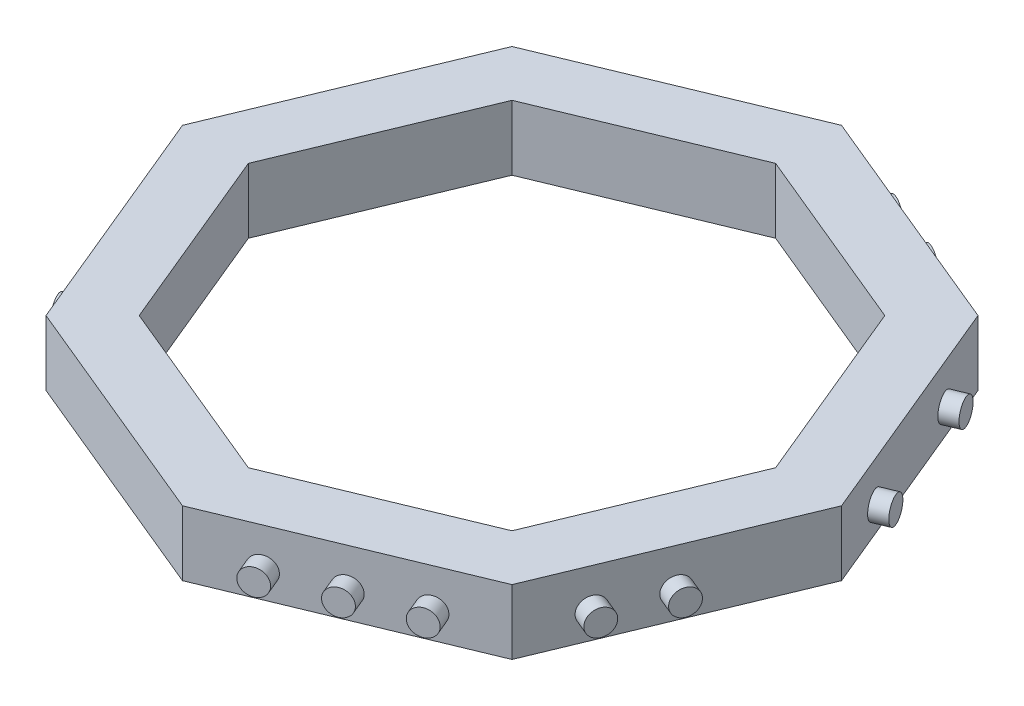
from build123d import *

# Parameters (mm, degrees)
BOSS_EXTRUDE1_DEPTH  = 5
CUT_EXTRUDE1_DEPTH   = 5
SKETCH6_R            = 1
BOSS_EXTRUDE5_DEPTH  = 1.25
SKETCH7_R            = 1
BOSS_EXTRUDE6_DEPTH  = 1.25
SKETCH8_R            = 1
BOSS_EXTRUDE7_DEPTH  = 1.25
BOSS_EXTRUDE8_START  = 1.25
SKETCH9_R            = 1
BOSS_EXTRUDE8_DEPTH  = 1.25
SKETCH10_R           = 1
BOSS_EXTRUDE9_DEPTH  = 1.25
BOSS_EXTRUDE10_START = 1.25
SKETCH11_R           = 1
BOSS_EXTRUDE10_DEPTH = 1.25
BOSS_EXTRUDE11_START = 1.25
SKETCH12_R           = 1
BOSS_EXTRUDE11_DEPTH = 1.25


with BuildPart() as part:
    # Sketch3 → Boss-Extrude1 (new body)
    with BuildSketch(Plane(origin=(0, 0, 0), x_dir=(1, 0, 0), z_dir=(0, 1, 0))):
        Polygon((25.4, 0), (17.960512242, 17.960512242), (0, 25.4), (-17.960512242, 17.960512242), (-25.4, 0), (-17.960512242, -17.960512242), (0, -25.4), (17.960512242, -17.960512242), align=None)
    extrude(amount=BOSS_EXTRUDE1_DEPTH)

    # Sketch5 → Cut-Extrude1 (cut)
    with BuildSketch(Plane(origin=(0, 5, 0), x_dir=(1, 0, 0), z_dir=(0, 1, 0))):
        Polygon((20.32, 0), (14.368409794, 14.368409794), (0, 20.32), (-14.368409794, 14.368409794), (-20.32, 0), (-14.368409794, -14.368409794), (0, -20.32), (14.368409794, -14.368409794), align=None)
    extrude(amount=-CUT_EXTRUDE1_DEPTH, mode=Mode.SUBTRACT)

    # Sketch6 → Boss-Extrude5 (add)
    with BuildSketch(Plane(origin=(8.980256121, 0, 21.680256121), x_dir=(0.9238795325112827, 0, -0.38268343236509966), z_dir=(0.38268343236509966, 0, 0.9238795325112827))):
        with Locations(Location((0, 2, 0), (0, 0, 180))):
            Circle(SKETCH6_R)
        with Locations(Location((-5, 2, 0), (0, 0, 180))):
            Circle(SKETCH6_R)
        with Locations(Location((5, 2, 0), (0, 0, 180))):
            Circle(SKETCH6_R)
    extrude(amount=BOSS_EXTRUDE5_DEPTH)

    # Sketch7 → Boss-Extrude6 (add)
    with BuildSketch(Plane(origin=(-21.680256121, 0, 8.980256121), x_dir=(0.3826834323650997, 0, 0.9238795325112827), z_dir=(-0.9238795325112827, 0, 0.3826834323650997))):
        with Locations(Location((5, 2, 0), (0, 0, 180))):
            Circle(SKETCH7_R)
    extrude(amount=BOSS_EXTRUDE6_DEPTH)

    # Sketch8 → Boss-Extrude7 (add)
    with BuildSketch(Plane(origin=(-21.680256121, 0, -8.980256121), x_dir=(-0.3826834323650795, 0, 0.9238795325112911), z_dir=(-0.9238795325112911, 0, -0.3826834323650795))):
        with Locations(Location((0, 2, 0), (0, 0, 180))):
            Circle(SKETCH8_R)
    extrude(amount=BOSS_EXTRUDE7_DEPTH)

    # Sketch9 → Boss-Extrude8 (add)
    with BuildSketch(Plane(origin=(-8.980256121, 0, -21.680256121), x_dir=(-0.9238795325112826, 0, 0.38268343236509983), z_dir=(-0.38268343236509983, 0, -0.9238795325112826)).offset(BOSS_EXTRUDE8_START)):
        with Locations((-5, 2)):
            Circle(SKETCH9_R)
    extrude(amount=-BOSS_EXTRUDE8_DEPTH)

    # Sketch10 → Boss-Extrude9 (add)
    with BuildSketch(Plane(origin=(8.980256121, 0, -21.680256121), x_dir=(-0.923879532511291, 0, -0.38268343236507973), z_dir=(0.38268343236507973, 0, -0.923879532511291))):
        with Locations(Location((0, 2, 0), (0, 0, 180))):
            Circle(SKETCH10_R)
        with Locations(Location((5, 2, 0), (0, 0, 180))):
            Circle(SKETCH10_R)
    extrude(amount=BOSS_EXTRUDE9_DEPTH)

    # Sketch11 → Boss-Extrude10 (add)
    with BuildSketch(Plane(origin=(21.680256121, 0, -8.980256121), x_dir=(-0.3826834323651001, 0, -0.9238795325112825), z_dir=(0.9238795325112824, 0, -0.38268343236510005)).offset(BOSS_EXTRUDE10_START)):
        with Locations(Location((5, 2, 0), (0, 0, 180))):
            Circle(SKETCH11_R)
        with Locations((-5, 2)):
            Circle(SKETCH11_R)
    extrude(amount=-BOSS_EXTRUDE10_DEPTH)

    # Sketch12 → Boss-Extrude11 (add)
    with BuildSketch(Plane(origin=(21.680256121, 0, 8.980256121), x_dir=(0.3826834323650795, 0, -0.923879532511291), z_dir=(0.9238795325112911, 0, 0.38268343236507957)).offset(BOSS_EXTRUDE11_START)):
        with Locations((0, 2)):
            Circle(SKETCH12_R)
        with Locations(Location((-5, 2, 0), (0, 0, 180))):
            Circle(SKETCH12_R)
    extrude(amount=-BOSS_EXTRUDE11_DEPTH)


solid = part.part
